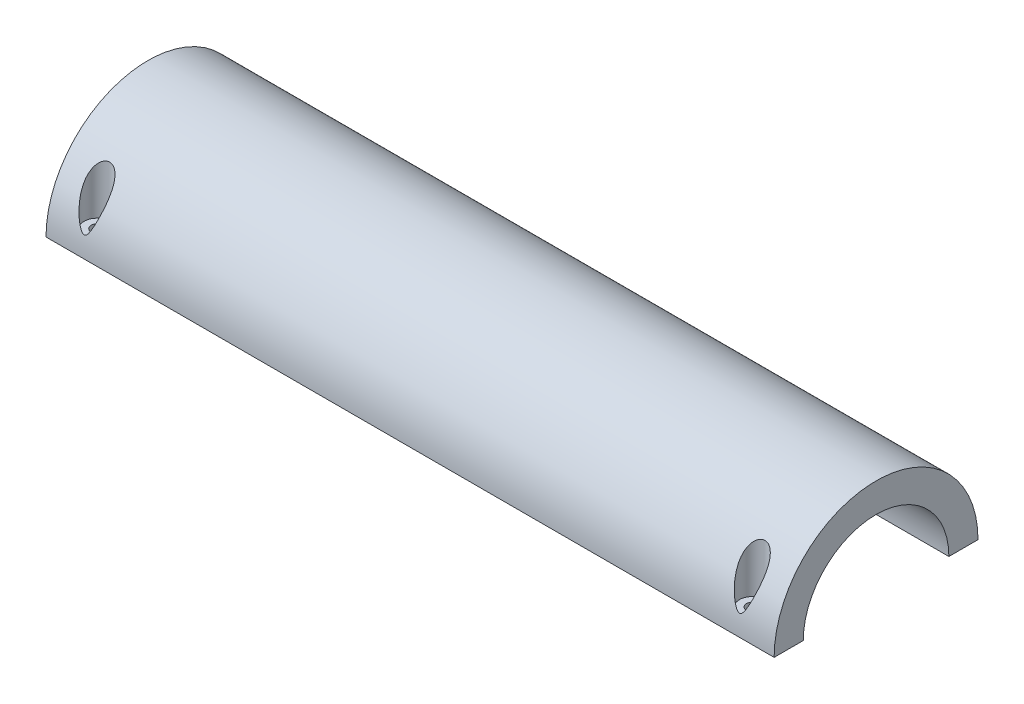
from build123d import *

# Parameters (mm, degrees)
AUFSATZ_LINEAR_AUSTRAGEN1_DEPTH = 200
SKIZZE2_R                       = 1.6
SCHNITT_LINEAR_AUSTRAGEN1_DEPTH = 204.882318998
SCHNITT_LINEAR_START            = -5
SKIZZE3_R                       = 3.5
SCHNITT_LINEAR_AUSTRAGEN2_DEPTH = 199.882319124


with BuildPart() as part:
    # Skizze1 → Aufsatz-Linear austragen1 (new body)
    with BuildSketch(Plane(origin=(0, 0, 0), x_dir=(0, 0, -1), z_dir=(1, 0, 0))):
        with BuildLine():
            Line((-28, 0), (-20, 0))
            ThreePointArc((-20, 0), (0, 20), (20, 0))
            Line((20, 0), (28, 0))
            ThreePointArc((28, 0), (0, 28), (-28, 0))
        make_face()
    extrude(amount=AUFSATZ_LINEAR_AUSTRAGEN1_DEPTH)

    # Skizze2 → Schnitt-Linear austragen1 (cut, through all)
    with BuildSketch(Plane.XZ):
        with Locations(Location((10, 24, 0), (0, 0, 270))):
            Circle(SKIZZE2_R)
        with Locations(Location((190, 24, 0), (0, 0, 270))):
            Circle(SKIZZE2_R)
        with Locations(Location((190, -24, 0), (0, 0, 270))):
            Circle(SKIZZE2_R)
        with Locations(Location((10, -24, 0), (0, 0, 270))):
            Circle(SKIZZE2_R)
    extrude(amount=-SCHNITT_LINEAR_AUSTRAGEN1_DEPTH, mode=Mode.SUBTRACT)

    # Skizze3 → Schnitt-Linear austragen2 (cut, through all)
    with BuildSketch(Plane.XZ.offset(SCHNITT_LINEAR_START)):
        with Locations(Location((10, 24, 0), (0, 0, 270))):
            Circle(SKIZZE3_R)
        with Locations(Location((190, 24, 0), (0, 0, 270))):
            Circle(SKIZZE3_R)
        with Locations(Location((190, -24, 0), (0, 0, 270))):
            Circle(SKIZZE3_R)
        with Locations(Location((10, -24, 0), (0, 0, 270))):
            Circle(SKIZZE3_R)
    extrude(amount=-SCHNITT_LINEAR_AUSTRAGEN2_DEPTH, mode=Mode.SUBTRACT)


solid = part.part
